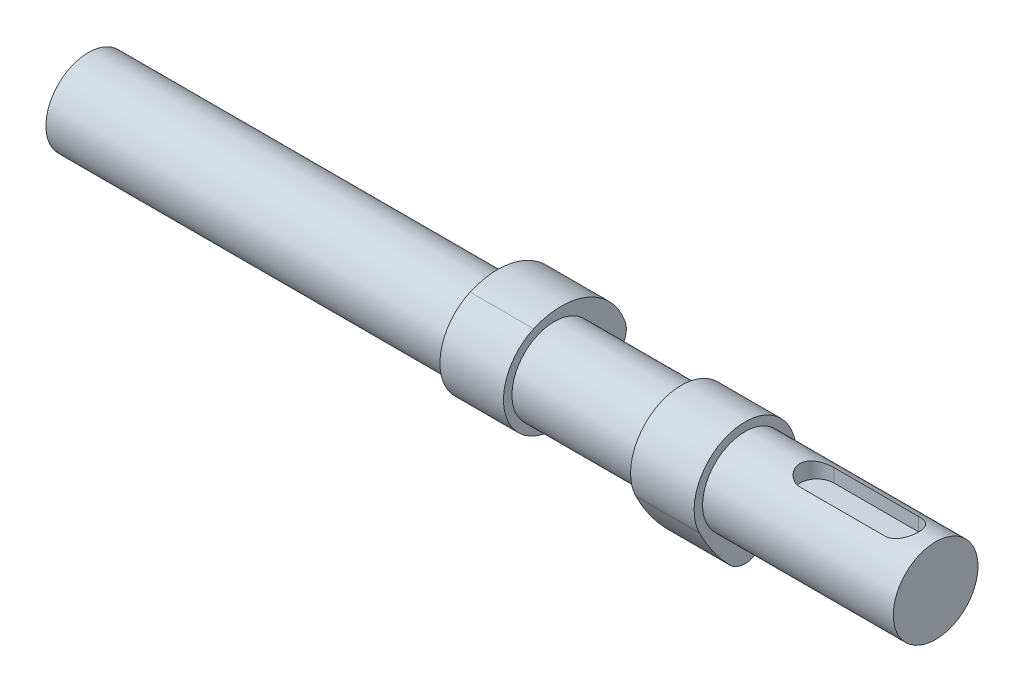
from build123d import *

# Parameters (mm, degrees)
BOSS_EXTRUDE1_DEPTH      = 75
BOSS_EXTRUDE1_DEPTH_BACK = 125
SKETCH1_R                = 10
BOSS_EXTRUDE2_START      = -15
BOSS_EXTRUDE2_DEPTH      = 15
BODY_MOVE_COPY2_ANGLE    = 90
CUT_EXTRUDE1_DEPTH       = 4


with BuildPart() as part:
    # Sketch1 → Boss-Extrude1 (new, two sides: drawn at the far end of the back side and taken through both)
    with BuildSketch(Plane(origin=(0, 0, 0), x_dir=(0, 0, -1), z_dir=(1, 0, 0)).offset(-BOSS_EXTRUDE1_DEPTH_BACK)):
        Circle(SKETCH1_R)
    extrude(amount=BOSS_EXTRUDE1_DEPTH + BOSS_EXTRUDE1_DEPTH_BACK)

    # Sketch5 → Cut-Extrude1 (cut)
    with BuildSketch(Plane(origin=(0, 10, 0), x_dir=(1, 0, 0), z_dir=(0, 1, 0))):
        with BuildLine():
            Line((47, 4), (67, 4))
            ThreePointArc((67, 4), (71, 0), (67, -4))
            Line((67, -4), (47, -4))
            ThreePointArc((47, -4), (43, 0), (47, 4))
        make_face()
    extrude(amount=-CUT_EXTRUDE1_DEPTH, mode=Mode.SUBTRACT)


with BuildPart() as body_2:
    # Sketch3 → Boss-Extrude2 (new body)
    with BuildSketch(Plane(origin=(0, 0, 0), x_dir=(0, 0, -1), z_dir=(1, 0, 0)).offset(BOSS_EXTRUDE2_START)):
        with BuildLine():
            ThreePointArc((-4.875, 10.965143638), (-10.866880674, -5.090275475), (5.303571429, -10.764391766))
            ThreePointArc((5.303571429, -10.764391766), (10.673861143, -7.574827955), (15.482142857, -3.588130589))
            ThreePointArc((15.482142857, -3.588130589), (16.867377987, -1.143954342), (16.715909091, 1.6613854))
            ThreePointArc((16.715909091, 1.6613854), (7.956738236, 11.038797462), (-4.875, 10.965143638))
        make_face()
    extrude(amount=-BOSS_EXTRUDE2_DEPTH)


with BuildPart() as body_3:
    # Mirror2: mirrored copy
    add(body_2.part.mirror(Plane(origin=(0, 0, 0), x_dir=(0, 0, 1), z_dir=(1, 0, 0))))


with BuildPart() as body_3_1:
    # Body-Move/Copy2: moved
    add(body_3.part.rotate(Axis((0, 0, 0), (-1, 0, 0)), BODY_MOVE_COPY2_ANGLE))


solid = Compound([part.part, body_2.part, body_3_1.part])
